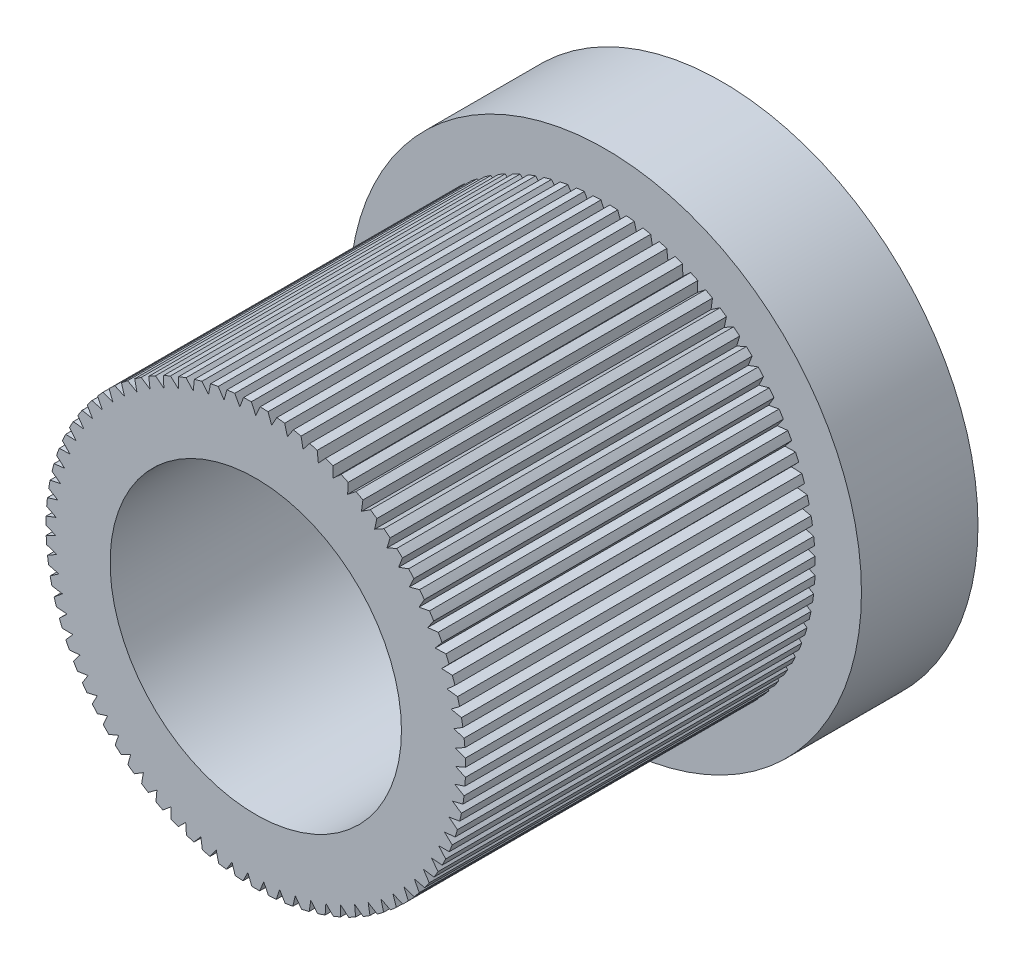
from build123d import *

# Parameters (mm, degrees)
SKIZZE1_R                       = 3.6
SKIZZE1_R_2                     = 2.5
AUFSATZ_LINEAR_AUSTRAGEN1_DEPTH = 8
SCHNITT_LINEAR_AUSTRAGEN2_DEPTH = 9
KREISMUSTER1_COUNT              = 79
SKIZZE3_R                       = 4.394533583
SKIZZE3_R_2                     = 2.5
AUFSATZ_LINEAR_AUSTRAGEN2_DEPTH = 2


with BuildPart() as part:
    # Skizze1 → Aufsatz-Linear austragen1 (new body)
    with BuildSketch(Plane.XY):
        Circle(SKIZZE1_R)
        Circle(SKIZZE1_R_2, mode=Mode.SUBTRACT)
    extrude(amount=AUFSATZ_LINEAR_AUSTRAGEN1_DEPTH)

    # Skizze2 → Schnitt-Linear austragen2 (cut)
    with BuildSketch(Plane(origin=(0, 0, 0), x_dir=(-1, 0, 0), z_dir=(0, 0, -1))):
        with BuildLine():
            Line((0, 3.432916841), (-0.075578283, 3.599206569))
            ThreePointArc((-0.075578283, 3.599206569), (0, 3.630512118), (0.075578283, 3.599206569))
            Line((0.075578283, 3.599206569), (0, 3.432916841))
        make_face()
    schnitt_linear_austragen2 = extrude(amount=-SCHNITT_LINEAR_AUSTRAGEN2_DEPTH, mode=Mode.SUBTRACT)

    # Kreismuster1: Schnitt-Linear austragen2 ×79 about axis
    kreismuster1_axis = Axis((0, 0, 0), (0, 0, 1))
    for i in range(1, KREISMUSTER1_COUNT):
        add(schnitt_linear_austragen2.rotate(kreismuster1_axis, i * 360 / KREISMUSTER1_COUNT), mode=Mode.SUBTRACT)

    # Skizze3 → Aufsatz-Linear austragen2 (add)
    with BuildSketch(Plane(origin=(0, 0, 0), x_dir=(-1, 0, 0), z_dir=(0, 0, -1))):
        Circle(SKIZZE3_R)
        with Locations(Location((0, 0, 0), (0, 0, 180))):
            Circle(SKIZZE3_R_2, mode=Mode.SUBTRACT)
    extrude(amount=-AUFSATZ_LINEAR_AUSTRAGEN2_DEPTH)


solid = part.part
